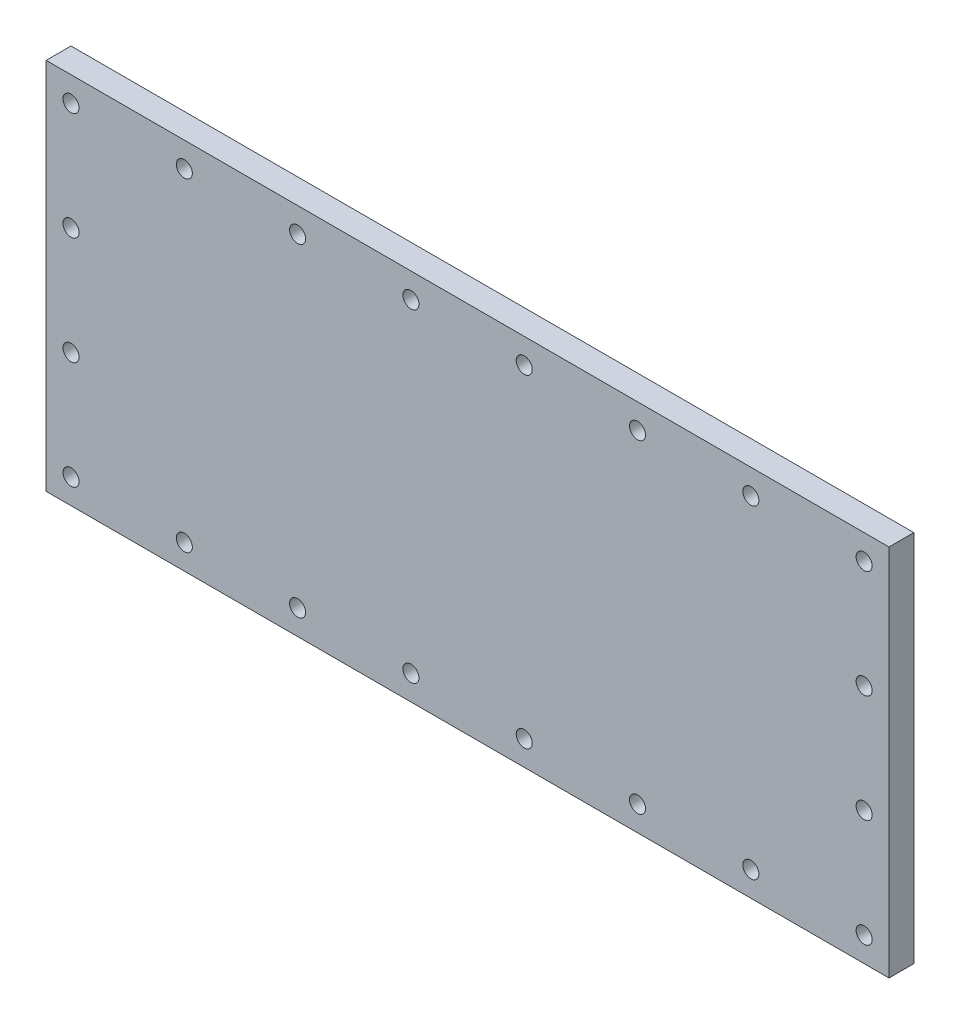
from build123d import *

# Parameters (mm, degrees)
SKETCH1_W           = 107.7
SKETCH1_H           = 47.7
SKETCH1_R           = 1.025
BOSS_EXTRUDE1_DEPTH = 3.175
CHAMFER1_SIZE       = 1


with BuildPart() as part:
    # Sketch1 → Boss-Extrude1 (new body)
    with BuildSketch(Plane.XY):
        Rectangle(SKETCH1_W, SKETCH1_H)
        with Locations((-50.675, 20.675)):
            Circle(SKETCH1_R, mode=Mode.SUBTRACT)
        with Locations((50.675, 20.675)):
            Circle(SKETCH1_R, mode=Mode.SUBTRACT)
        with Locations((-50.675, -20.675)):
            Circle(SKETCH1_R, mode=Mode.SUBTRACT)
        with Locations((50.675, -20.675)):
            Circle(SKETCH1_R, mode=Mode.SUBTRACT)
        with Locations((-7.239285714, 20.675)):
            Circle(SKETCH1_R, mode=Mode.SUBTRACT)
        with Locations((-7.239285714, -20.675)):
            Circle(SKETCH1_R, mode=Mode.SUBTRACT)
        with Locations((-36.196428571, 20.675)):
            Circle(SKETCH1_R, mode=Mode.SUBTRACT)
        with Locations((-21.717857143, 20.675)):
            Circle(SKETCH1_R, mode=Mode.SUBTRACT)
        with Locations((7.239285714, 20.675)):
            Circle(SKETCH1_R, mode=Mode.SUBTRACT)
        with Locations((21.717857143, 20.675)):
            Circle(SKETCH1_R, mode=Mode.SUBTRACT)
        with Locations((-50.675, 6.8916667)):
            Circle(SKETCH1_R, mode=Mode.SUBTRACT)
        with Locations((-50.675, -6.8916667)):
            Circle(SKETCH1_R, mode=Mode.SUBTRACT)
        with Locations((50.675, 6.8916667)):
            Circle(SKETCH1_R, mode=Mode.SUBTRACT)
        with Locations((50.675, -6.8916667)):
            Circle(SKETCH1_R, mode=Mode.SUBTRACT)
        with Locations((7.239285714, -20.675)):
            Circle(SKETCH1_R, mode=Mode.SUBTRACT)
        with Locations((21.717857143, -20.675)):
            Circle(SKETCH1_R, mode=Mode.SUBTRACT)
        with Locations((-21.717857143, -20.675)):
            Circle(SKETCH1_R, mode=Mode.SUBTRACT)
        with Locations((-36.196428571, -20.675)):
            Circle(SKETCH1_R, mode=Mode.SUBTRACT)
        with Locations((36.196428572, 20.675)):
            Circle(SKETCH1_R, mode=Mode.SUBTRACT)
        with Locations((36.196428572, -20.675)):
            Circle(SKETCH1_R, mode=Mode.SUBTRACT)
    extrude(amount=BOSS_EXTRUDE1_DEPTH)

    # Chamfer1
    chamfer1_edges = [part.edges().sort_by_distance(p)[0] for p in [
        (-51.7, 20.675, 0),
        (49.65, 20.675, 0),
        (-51.7, -20.675, 0),
        (49.65, -20.675, 0),
        (-8.264285714, 20.675, 0),
        (-8.264285714, -20.675, 0),
        (-37.221428571, 20.675, 0),
        (-22.742857143, 20.675, 0),
        (6.214285714, 20.675, 0),
        (20.692857143, 20.675, 0),
        (-51.7, 6.8916667, 0),
        (-51.7, -6.8916667, 0),
        (49.65, 6.8916667, 0),
        (49.65, -6.8916667, 0),
        (6.214285714, -20.675, 0),
        (20.692857143, -20.675, 0),
        (-22.742857143, -20.675, 0),
        (-37.221428571, -20.675, 0),
        (35.171428572, 20.675, 0),
        (35.171428572, -20.675, 0),
    ]]
    chamfer(chamfer1_edges, length=CHAMFER1_SIZE)


solid = part.part
